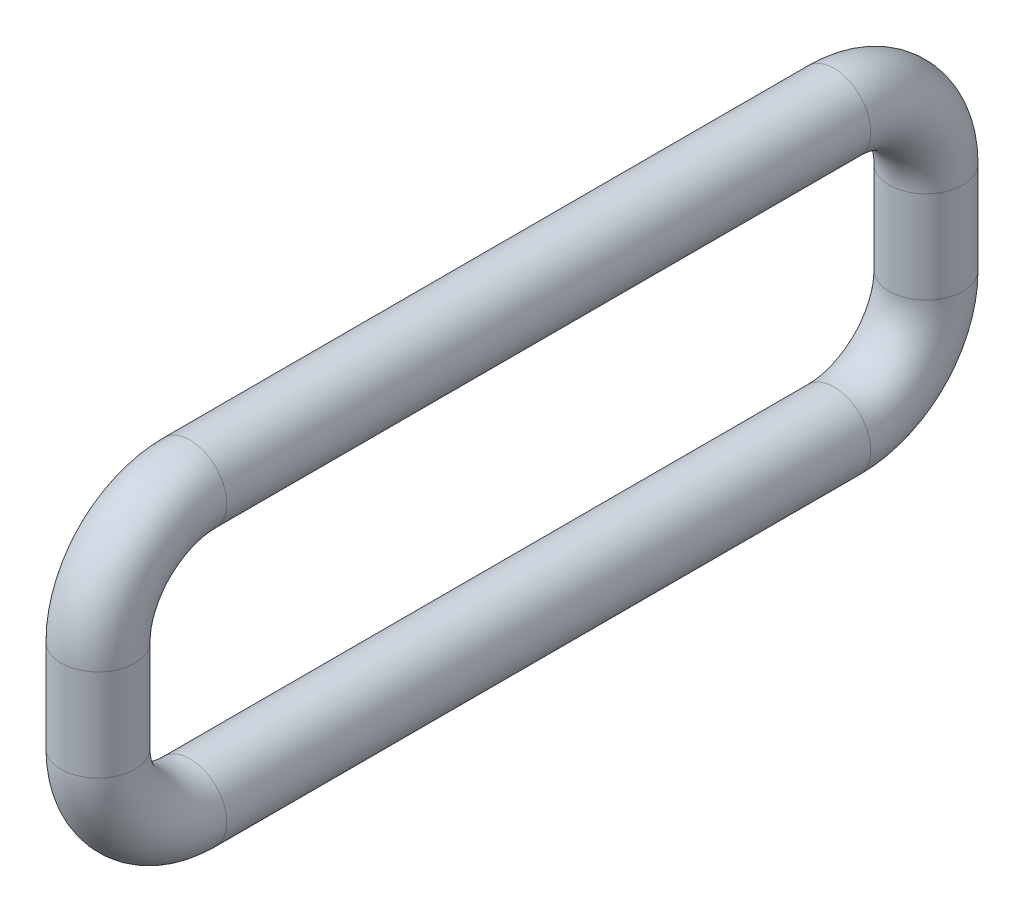
from build123d import *

# Parameters (mm, degrees)
SKETCH_2_R = 4


with BuildPart() as part:
    # По траектории1: sweep along a path in Эскиз1
    with BuildLine(Plane(origin=(0, 0, 0), x_dir=(0, 0, -1), z_dir=(1, 0, 0))) as sweep_1_path:
        Line((0, -15), (35, -15))
        ThreePointArc((35, -15), (42.071067812, -12.071067812), (45, -5))
        Line((45, -5), (45, 5))
        ThreePointArc((45, 5), (42.071067812, 12.071067812), (35, 15))
        Line((35, 15), (0, 15))
    # Эскиз2 → По траектории1 (sweep)
    with BuildSketch(Plane.XY):
        with Locations((0, -15)):
            Circle(SKETCH_2_R)
    sweep(path=sweep_1_path.line)

    # Зеркальное отражение1: part across face


with BuildPart() as part_1:
    add(part.part)
    add(part.part.mirror(Plane(origin=(0, 15, 0), x_dir=(1, 0, 0), z_dir=(0, 0, 1))))


solid = part_1.part
